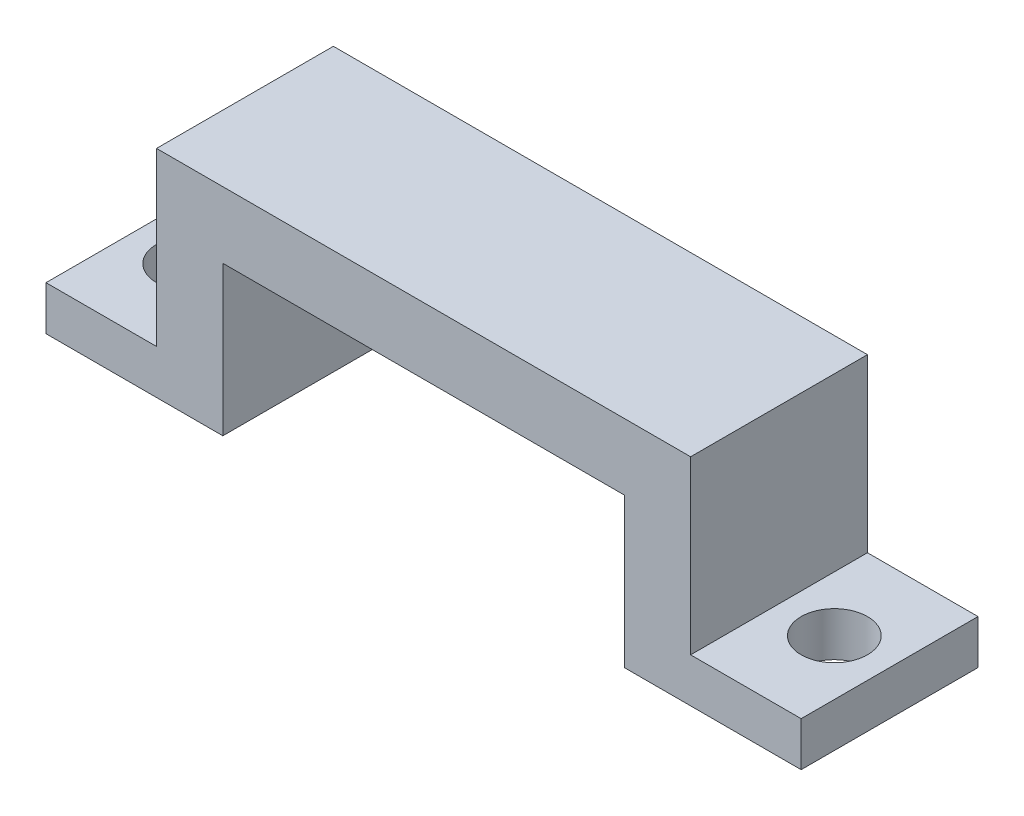
from build123d import *

# Parameters (mm, degrees)
BOSS_EXTRUDE1_DEPTH      = 8
F_3_0_3_DIAMETER_HOLE1_D = 3


with BuildPart() as part:
    # Sketch2 → Boss-Extrude1 (new body)
    with BuildSketch(Plane.XY):
        Polygon((11.93, -3.38), (16.93, -3.38), (16.93, -1.38), (11.93, -1.38), (11.93, 6.38), (-12.23, 6.38), (-12.23, -1.38), (-17.23, -1.38), (-17.23, -3.38), (-12.23, -3.38), (-9.23, -3.38), (-9.23, 3.38), (8.93, 3.38), (8.93, -3.38), align=None)
    extrude(amount=BOSS_EXTRUDE1_DEPTH)

    # Ø3.0 (3) Diameter Hole1 (through all)
    with Locations(Plane(origin=(0, -1.38, 0), x_dir=(1, 0, 0), z_dir=(0, 1, 0))):
        with Locations((14.43, -4), (-14.73, -4)):
            Hole(F_3_0_3_DIAMETER_HOLE1_D / 2)


solid = part.part
